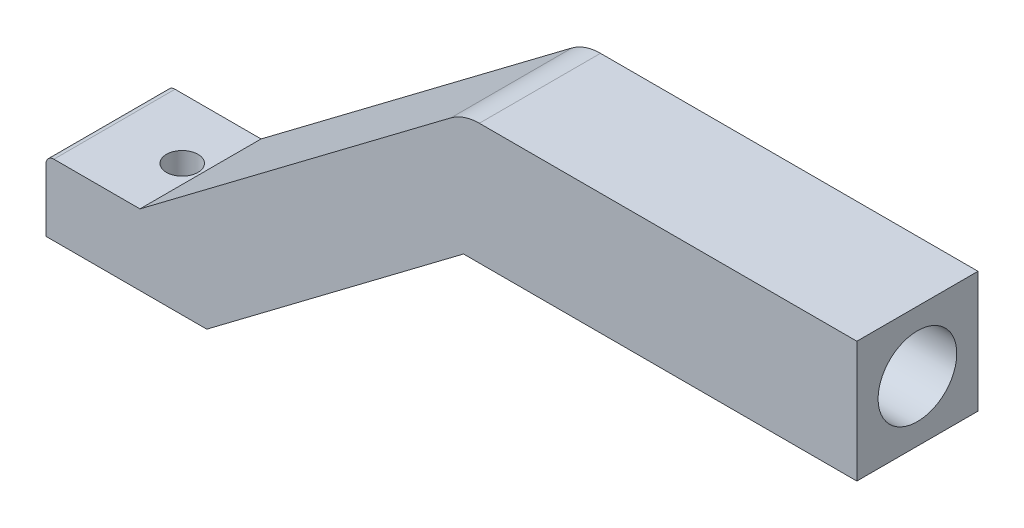
from build123d import *

# Parameters (mm, degrees)
EXTRUDE_408_DEPTH      = 7.7
FILLET_1_R             = 3
SKETCH_4_R             = 2.5
CUT_EXTRUDE_703_DEPTH  = 10
SKETCH_5_R             = 1
CUT_EXTRUDE_1066_DEPTH = 47.549452316
FILLET_3_R             = 0.5


with BuildPart() as part:
    # 草图1 → Extrude 408 (new body)
    with BuildSketch(Plane.XY):
        Polygon((0, 0), (16.322651306, 12.3), (41.322651306, 12.3), (41.322651306, 20), (16.322651306, 20), (-4.246543429, 4.5), (-10.218245126, 4.5), (-10.218245126, 0), align=None)
    extrude(amount=EXTRUDE_408_DEPTH)

    # 圆角1
    fillet_1_edges = [part.edges().sort_by_distance(p)[0] for p in [
        (16.322651306, 20, 3.85),
    ]]
    fillet(fillet_1_edges, radius=FILLET_1_R)

    # 草图4 → Cut-Extrude 703 (cut)
    with BuildSketch(Plane(origin=(41.322651306, 0, 0), x_dir=(0, 0, -1), z_dir=(1, 0, 0))):
        with Locations(Location((-3.85, 16.15, 0), (0, 0, 90))):
            Circle(SKETCH_4_R)
    extrude(amount=-CUT_EXTRUDE_703_DEPTH, mode=Mode.SUBTRACT)

    # 草图5 → Cut-Extrude 1066 (cut, through all)
    with BuildSketch(Plane.XZ):
        with Locations((-5.409122563, 3.85)):
            Circle(SKETCH_5_R)
    extrude(amount=-CUT_EXTRUDE_1066_DEPTH, mode=Mode.SUBTRACT)

    # 圆角3
    fillet_3_edges = [part.edges().sort_by_distance(p)[0] for p in [
        (-10.218245126, 4.5, 3.85),
    ]]
    fillet(fillet_3_edges, radius=FILLET_3_R)


solid = part.part
